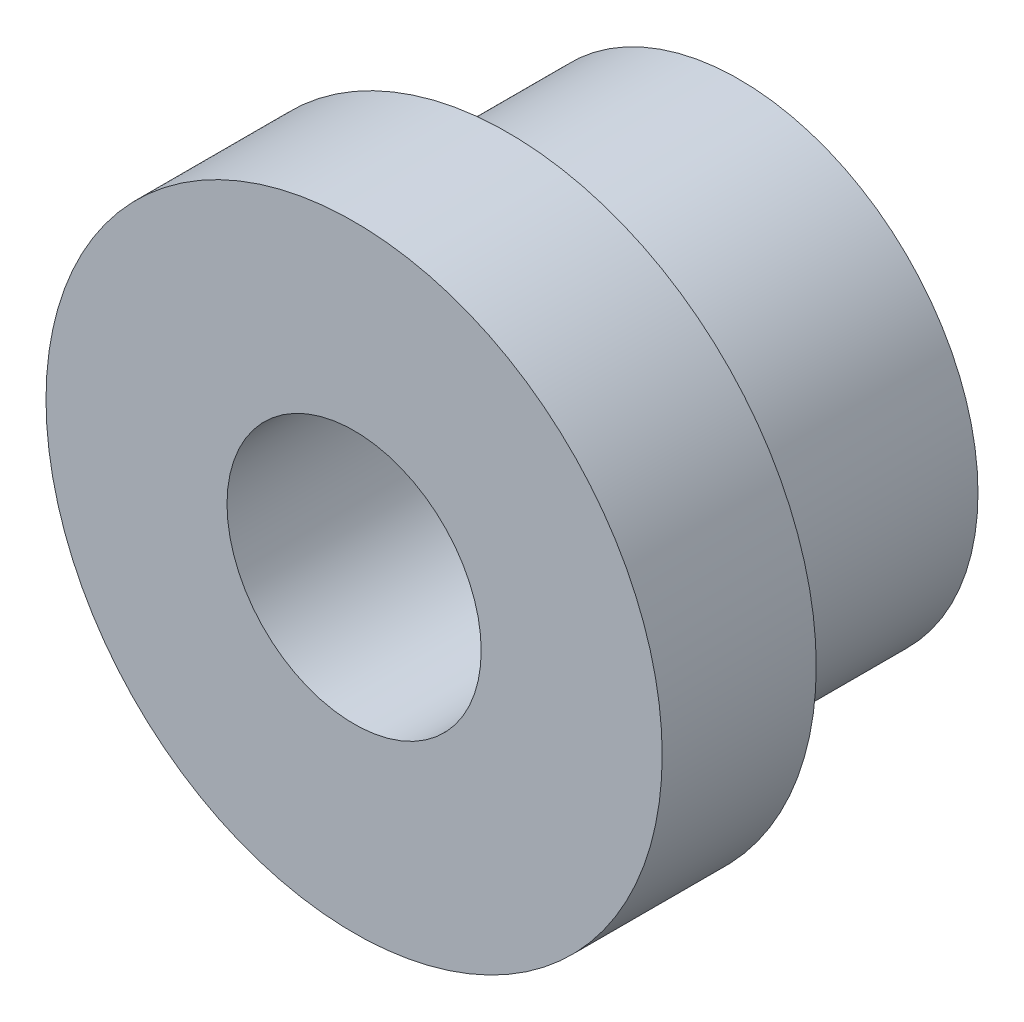
from build123d import *

# Parameters (mm, degrees)
SKETCH_1_R      = 3.1
SKETCH_1_R_2    = 1.65
EXTRUDE_1_DEPTH = 3
SKETCH_2_R      = 4
SKETCH_2_R_2    = 1.65
EXTRUDE_2_DEPTH = 2


with BuildPart() as part:
    # 草图1 → 凸台-拉伸1 (new body)
    with BuildSketch(Plane.XY):
        Circle(SKETCH_1_R)
        Circle(SKETCH_1_R_2, mode=Mode.SUBTRACT)
    extrude(amount=EXTRUDE_1_DEPTH)

    # 草图2 → 凸台-拉伸2 (add)
    with BuildSketch(Plane.XY.offset(3)):
        Circle(SKETCH_2_R)
        Circle(SKETCH_2_R_2, mode=Mode.SUBTRACT)
    extrude(amount=EXTRUDE_2_DEPTH)


solid = part.part
